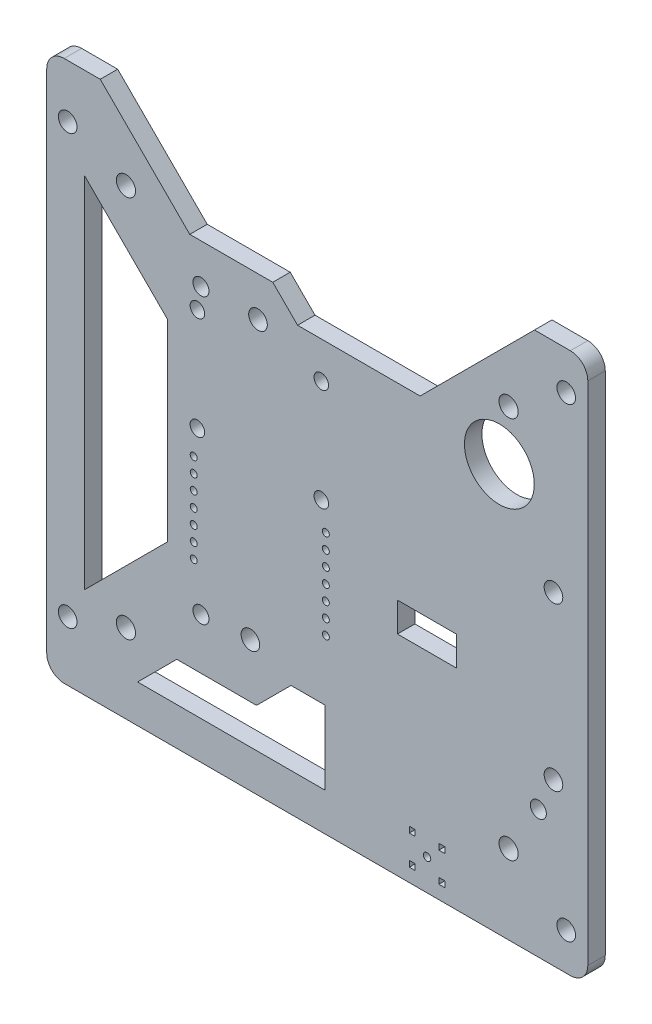
from build123d import *

# Parameters (mm, degrees)
SKETCH1_W           = 92.97433
SKETCH1_H           = 93
BOSS_EXTRUDE1_DEPTH = 3
FILLET1_R           = 3
CUT_EXTRUDE1_DEPTH  = 3
SKETCH3_R           = 1.6
SKETCH3_R_2         = 1.65
SKETCH3_R_3         = 1.375
CUT_EXTRUDE2_DEPTH  = 3
SKETCH4_R           = 1.6
SKETCH4_R_2         = 1.65
SKETCH4_R_3         = 1.375
CUT_EXTRUDE3_DEPTH  = 3
SKETCH5_R           = 1.25
SKETCH5_R_2         = 0.6
CUT_EXTRUDE4_DEPTH  = 66.820259113
SKETCH2_3_W         = 10.17
SKETCH2_3_H         = 5.05
SKETCH2_3_W_2       = 1.02
SKETCH2_3_H_2       = 1.02
CUT_EXTRUDE5_DEPTH  = 10
SKETCH7_R           = 6
CUT_EXTRUDE6_DEPTH  = 66.820259113


with BuildPart() as part:
    # Sketch1 → Boss-Extrude1 (new body)
    with BuildSketch(Plane.XY):
        Rectangle(SKETCH1_W, SKETCH1_H)
    extrude(amount=BOSS_EXTRUDE1_DEPTH)

    # Fillet1
    fillet1_edges = [part.edges().sort_by_distance(p)[0] for p in [
        (46.487165, -46.5, 1.5),
        (-46.487165, -46.5, 1.5),
        (-46.487165, 46.5, 1.5),
        (46.487165, 46.5, 1.5),
    ]]
    fillet(fillet1_edges, radius=FILLET1_R)

    # Sketch2 → Cut-Extrude1 (cut)
    with BuildSketch(Plane.XY.offset(3)):
        Polygon((-39.987165, 30.80761), (-39.987165, -30.80761), (-25.722107704, -16.54254623), (-25.722107704, 16.54254623), align=None)
        Polygon((-37.295165, 46.5), (-21.908517975, 31.113359908), (-7.648517975, 31.113359908), (-3.384663123, 26.849506978), (17.674350896, 26.849506978), (37.324835, 46.5), align=None)
        Polygon((-24.13996688, -33.24619021), (-30.87162192, -39.977848283), (1.328948971, -39.977593006), (1.328948971, -27.320634039), (-4.514413398, -27.320634039), (-10.43996688, -33.24619021), align=None)
    extrude(amount=-CUT_EXTRUDE1_DEPTH, mode=Mode.SUBTRACT)

    # Sketch3 → Cut-Extrude2 (cut)
    with BuildSketch(Plane.XY.offset(3)):
        with Locations((-42.887165, 37.38)):
            Circle(SKETCH3_R)
        with Locations((-32.877165, 32.89)):
            Circle(SKETCH3_R_2)
        with Locations((-19.987165, 24.3)):
            Circle(SKETCH3_R_3)
        with Locations((-10.187165, 24.3)):
            Circle(SKETCH3_R)
    extrude(amount=-CUT_EXTRUDE2_DEPTH, mode=Mode.SUBTRACT)

    # Sketch4 → Cut-Extrude3 (cut)
    with BuildSketch(Plane.XY.offset(3)):
        with Locations((42.777165, -40.07)):
            Circle(SKETCH4_R)
        with Locations((32.877165, -32.89)):
            Circle(SKETCH4_R_2)
        with Locations((37.987165, -24.5)):
            Circle(SKETCH4_R_3)
        with Locations((40.587165, -18.8)):
            Circle(SKETCH4_R)
        with Locations((-42.887165, -36.27)):
            Circle(SKETCH4_R)
        with Locations((-32.877165, -32.89)):
            Circle(SKETCH4_R_2)
        with Locations((-19.987165, -24.5)):
            Circle(SKETCH4_R_3)
        with Locations((-11.487165, -24)):
            Circle(SKETCH4_R)
        with Locations((42.777165, 39.9)):
            Circle(SKETCH4_R)
        with Locations((32.877165, 32.89)):
            Circle(SKETCH4_R_2)
        with Locations((40.587165, 9.1)):
            Circle(SKETCH4_R)
    extrude(amount=-CUT_EXTRUDE3_DEPTH, mode=Mode.SUBTRACT)

    # Sketch5 → Cut-Extrude4 (cut, through all)
    with BuildSketch(Plane.XY.offset(3)):
        with Locations((0.691290951, 20.56)):
            Circle(SKETCH5_R)
        with Locations((-20.598709049, 20.56)):
            Circle(SKETCH5_R)
        with Locations((0.691290951, 2.9)):
            Circle(SKETCH5_R)
        with Locations((-20.598709049, 2.9)):
            Circle(SKETCH5_R)
        with Locations((-21.228709049, -1.6)):
            Circle(SKETCH5_R_2)
        with Locations((-21.228709049, -4.15)):
            Circle(SKETCH5_R_2)
        with Locations((-21.228709049, -6.7)):
            Circle(SKETCH5_R_2)
        with Locations((-21.228709049, -9.25)):
            Circle(SKETCH5_R_2)
        with Locations((-21.228709049, -11.8)):
            Circle(SKETCH5_R_2)
        with Locations((-21.228709049, -14.35)):
            Circle(SKETCH5_R_2)
        with Locations((-21.228709049, -16.9)):
            Circle(SKETCH5_R_2)
        with Locations((1.471290951, -1.6)):
            Circle(SKETCH5_R_2)
        with Locations((1.471290951, -4.15)):
            Circle(SKETCH5_R_2)
        with Locations((1.471290951, -6.7)):
            Circle(SKETCH5_R_2)
        with Locations((1.471290951, -9.25)):
            Circle(SKETCH5_R_2)
        with Locations((1.471290951, -11.8)):
            Circle(SKETCH5_R_2)
        with Locations((1.471290951, -14.35)):
            Circle(SKETCH5_R_2)
        with Locations((1.471290951, -16.9)):
            Circle(SKETCH5_R_2)
    extrude(amount=-CUT_EXTRUDE4_DEPTH, mode=Mode.SUBTRACT)

    # Sketch2<3> → Cut-Extrude5 (cut)
    with BuildSketch(Plane.XY.offset(3)):
        with Locations((18.862165, -7.995)):
            Rectangle(SKETCH2_3_W, SKETCH2_3_H)
        with Locations((16.322165, -38.61)):
            Rectangle(SKETCH2_3_W_2, SKETCH2_3_H_2)
        with Locations((21.402165, -38.61)):
            Rectangle(SKETCH2_3_W_2, SKETCH2_3_H_2)
        with BuildLine():
            ThreePointArc((19.502165, -41.15), (19.31471334, -40.69745166), (18.862165, -40.51))
            Line((18.862165, -40.51), (18.862165, -41.15))
            Line((18.862165, -41.15), (19.502165, -41.15))
        make_face()
        with BuildLine():
            Line((18.862165, -41.15), (18.862165, -40.51))
            ThreePointArc((18.862165, -40.51), (18.40961666, -40.69745166), (18.222165, -41.15))
            Line((18.222165, -41.15), (18.862165, -41.15))
        make_face()
        with BuildLine():
            Line((19.502165, -41.15), (18.862165, -41.15))
            Line((18.862165, -41.15), (18.862165, -41.79))
            ThreePointArc((18.862165, -41.79), (19.31471334, -41.60254834), (19.502165, -41.15))
        make_face()
        with BuildLine():
            Line((18.862165, -41.79), (18.862165, -41.15))
            Line((18.862165, -41.15), (18.222165, -41.15))
            ThreePointArc((18.222165, -41.15), (18.40961666, -41.60254834), (18.862165, -41.79))
        make_face()
        with Locations((21.402165, -43.69)):
            Rectangle(SKETCH2_3_W_2, SKETCH2_3_H_2)
        with Locations((16.322165, -43.69)):
            Rectangle(SKETCH2_3_W_2, SKETCH2_3_H_2)
    extrude(amount=-CUT_EXTRUDE5_DEPTH, mode=Mode.SUBTRACT)

    # Sketch7 → Cut-Extrude6 (cut, through all)
    with BuildSketch(Plane.XY.offset(3)):
        with Locations((31.287165, 23.5)):
            Circle(SKETCH7_R)
    extrude(amount=-CUT_EXTRUDE6_DEPTH, mode=Mode.SUBTRACT)


solid = part.part
